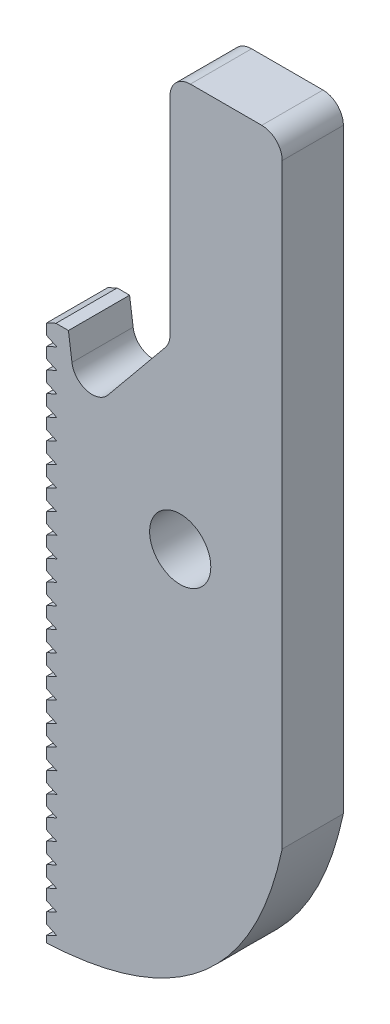
from build123d import *

# Parameters (mm, degrees)
SKETCH_1_W             = 10
SKETCH_1_H             = 40
SKETCH_1_R             = 1.5
EXTRUDE_1_DEPTH        = 3
SKETCH_2_W             = 1.55
SKETCH_2_H             = 40
EXTRUDE_2_DEPTH        = 3
CUT_EXTRUDE_1_DEPTH    = 3
PATTERN_LINEAR_1_COUNT = 40
PATTERN_LINEAR_1_PITCH = 1
CUT_EXTRUDE_2_DEPTH    = 10
FILLET_1_R             = 1
CUT_EXTRUDE_3_DEPTH    = 10
FILLET_2_R             = 1


with BuildPart() as part:
    # 草图1 → 凸台-拉伸1 (new body)
    with BuildSketch(Plane.XY):
        Rectangle(SKETCH_1_W, SKETCH_1_H)
        Circle(SKETCH_1_R, mode=Mode.SUBTRACT)
    extrude(amount=EXTRUDE_1_DEPTH)

    # 草图2 → 凸台-拉伸2 (add)
    with BuildSketch(Plane.XY.offset(3)):
        with Locations((-5.775, 0)):
            Rectangle(SKETCH_2_W, SKETCH_2_H)
    extrude(amount=-EXTRUDE_2_DEPTH)

    # 草图3 → 切除-拉伸1 (cut)
    with BuildSketch(Plane.XY.offset(3)):
        Polygon((-6.55, 19.8), (-6.05, 19.566846171), (-6.55, 19.333692342), align=None)
    cut_extrude_1 = extrude(amount=-CUT_EXTRUDE_1_DEPTH, mode=Mode.SUBTRACT)

    # 阵列(线性)1: 切除-拉伸1 ×40
    with Locations(*[(0, -i * PATTERN_LINEAR_1_PITCH, 0) for i in range(1, PATTERN_LINEAR_1_COUNT)]):
        add(cut_extrude_1, mode=Mode.SUBTRACT)

    # 草图5 → 切除-拉伸2 (cut)
    with BuildSketch(Plane.XY.offset(3)):
        Polygon((-0.5, 20), (-0.5, 8.485281374), (-5, 3), (-5.480467746, 6.547419937), (-7.040068743, 6.547419937), (-7.040068743, 9.445607815), (-8.18437591, 20), align=None)
    extrude(amount=-CUT_EXTRUDE_2_DEPTH, mode=Mode.SUBTRACT)

    # 圆角1
    fillet_1_edges = [part.edges().sort_by_distance(p)[0] for p in [
        (-0.5, 8.485281374, 1.5),
        (-5, 3, 1.5),
    ]]
    fillet(fillet_1_edges, radius=FILLET_1_R)

    # 草图7 → 切除-拉伸3 (cut)
    with BuildSketch(Plane(origin=(0, 0, 0), x_dir=(-1, 0, 0), z_dir=(0, 0, -1))):
        with BuildLine():
            Line((6.55, -20), (-5.418170251, -22.566873238))
            Line((-5.418170251, -22.566873238), (-10.062870934, -14.075772272))
            Line((-10.062870934, -14.075772272), (-5, -10.23011241))
            add(Edge.make_bspline(
                [(-5, -10.23011241), (-3.025837533, -19.554793567), (6.55, -20)],
                knots=[0, 0, 0, 1, 1, 1], degree=2))
        make_face()
    extrude(amount=-CUT_EXTRUDE_3_DEPTH, mode=Mode.SUBTRACT)

    # 圆角2
    fillet_2_edges = [part.edges().sort_by_distance(p)[0] for p in [
        (-0.5, 20, 1.5),
        (5, 20, 1.5),
    ]]
    fillet(fillet_2_edges, radius=FILLET_2_R)


solid = part.part
